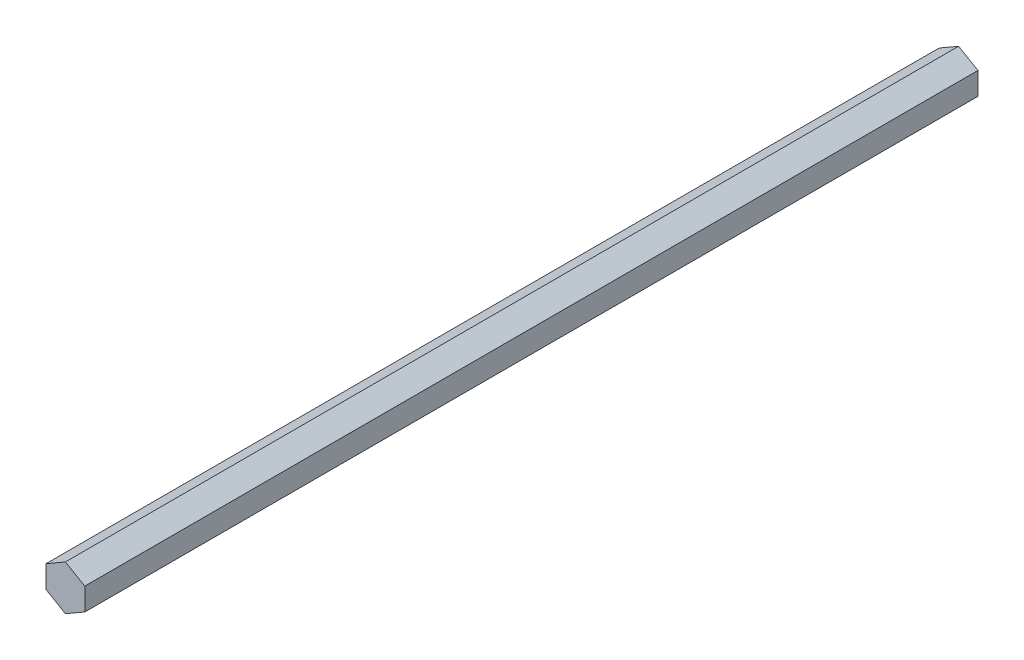
from build123d import *

# Parameters (mm, degrees)
BOSS_EXTRUDE1_DEPTH = 292.1


with BuildPart() as part:
    # Sketch1 → Boss-Extrude1 (new body)
    with BuildSketch(Plane.XY):
        Polygon((6.35, 3.666174209), (0, 7.332348419), (-6.35, 3.666174209), (-6.35, -3.666174209), (0, -7.332348419), (6.35, -3.666174209), align=None)
    extrude(amount=BOSS_EXTRUDE1_DEPTH)


solid = part.part
